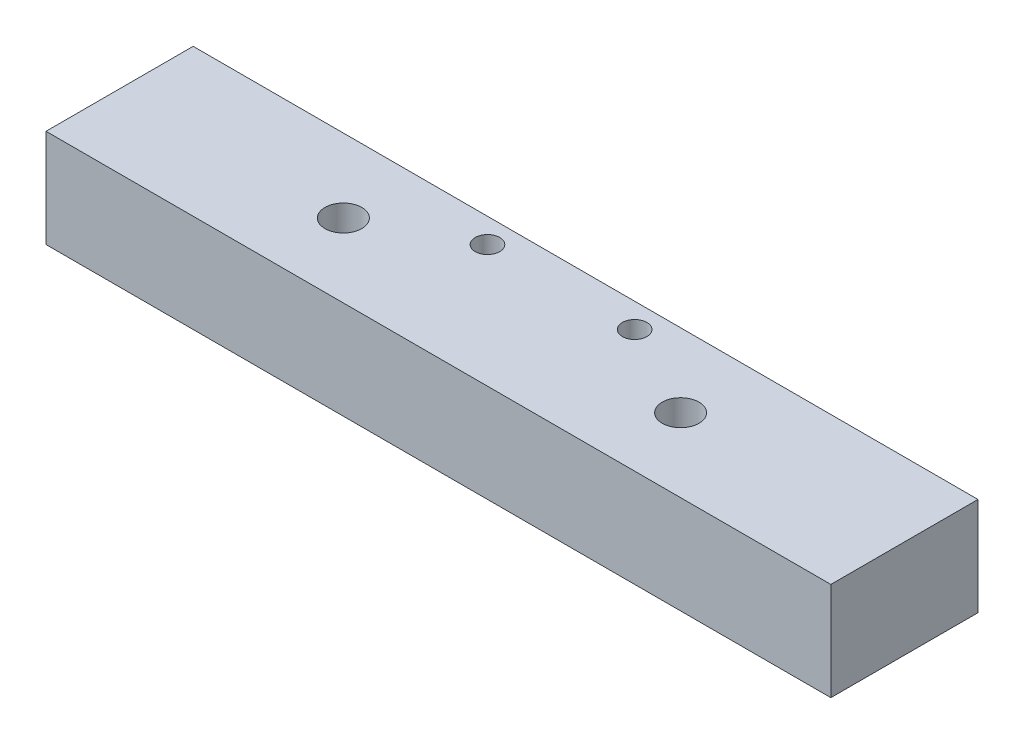
from build123d import *

# Parameters (mm, degrees)
SKETCH1_W           = 406.4
SKETCH1_H           = 76.2
BOSS_EXTRUDE1_DEPTH = 50.8
SKETCH3_R           = 9.525
CUT_EXTRUDE1_DEPTH  = 50.8
SKETCH4_R           = 6.35
CUT_EXTRUDE2_DEPTH  = 8.89


with BuildPart() as part:
    # Sketch1 → Boss-Extrude1 (new body)
    with BuildSketch(Plane(origin=(0, 0, 0), x_dir=(1, 0, 0), z_dir=(0, 1, 0))):
        Rectangle(SKETCH1_W, SKETCH1_H)
    extrude(amount=BOSS_EXTRUDE1_DEPTH)

    # Sketch3 → Cut-Extrude1 (cut)
    with BuildSketch(Plane(origin=(0, 50.8, 0), x_dir=(1, 0, 0), z_dir=(0, 1, 0))):
        with Locations(Location((87.3125, 0, 0), (0, 0, 270))):
            Circle(SKETCH3_R)
    cut_extrude1 = extrude(amount=-CUT_EXTRUDE1_DEPTH, mode=Mode.SUBTRACT)

    # Sketch4 → Cut-Extrude2 (cut)
    with BuildSketch(Plane(origin=(0, 50.8, 0), x_dir=(1, 0, 0), z_dir=(0, 1, 0))):
        with Locations(Location((38.1, 25.4, 0), (0, 0, 270))):
            Circle(SKETCH4_R)
    cut_extrude2 = extrude(amount=-CUT_EXTRUDE2_DEPTH, mode=Mode.SUBTRACT)

    # Mirror1: Cut-Extrude1, Cut-Extrude2 across plane
    add(cut_extrude1.mirror(Plane(origin=(0, 0, 0), x_dir=(0, 0, 1), z_dir=(1, 0, 0))), mode=Mode.SUBTRACT)
    add(cut_extrude2.mirror(Plane(origin=(0, 0, 0), x_dir=(0, 0, 1), z_dir=(1, 0, 0))), mode=Mode.SUBTRACT)


solid = part.part
